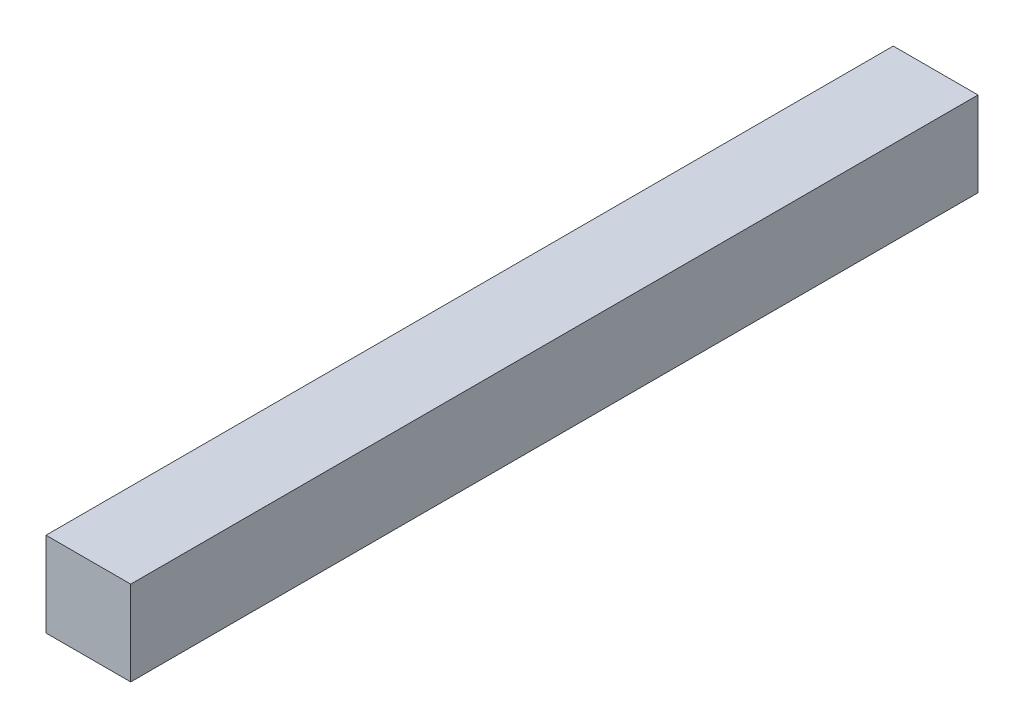
from build123d import *

# Parameters (mm, degrees)
SKETCH_1_W      = 30
SKETCH_1_H      = 30
EXTRUDE_1_DEPTH = 150


with BuildPart() as part:
    # 草图1 → 凸台-拉伸1 (new, symmetric)
    with BuildSketch(Plane.XY):
        Rectangle(SKETCH_1_W, SKETCH_1_H)
    extrude(amount=EXTRUDE_1_DEPTH, both=True)


solid = part.part
